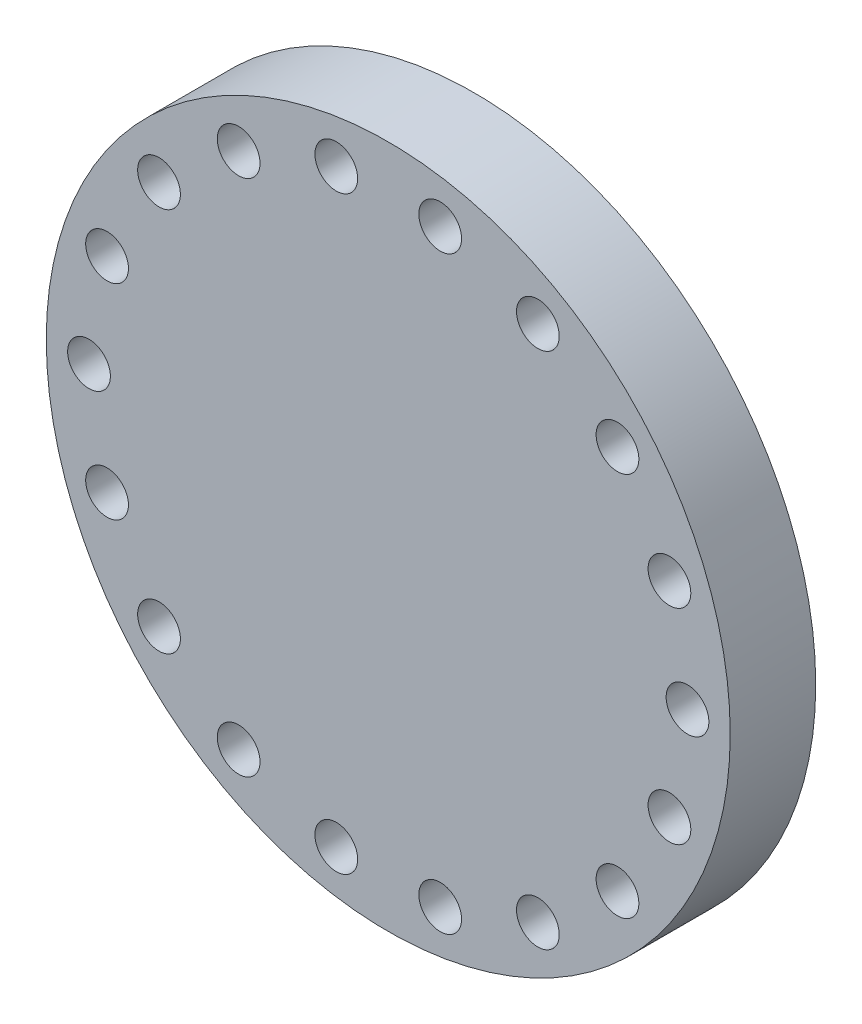
from build123d import *

# Parameters (mm, degrees)
SKETCH1_R           = 50.8
BOSS_EXTRUDE2_DEPTH = 12.7
SKETCH1_7_R         = 3.175
CUT_EXTRUDE1_DEPTH  = 12.7


with BuildPart() as part:
    # Sketch1 → Boss-Extrude2 (new body)
    with BuildSketch(Plane.XY):
        Circle(SKETCH1_R)
    extrude(amount=-BOSS_EXTRUDE2_DEPTH)

    # Sketch1<7> → Cut-Extrude1 (cut)
    with BuildSketch(Plane.XY):
        with Locations((-44.45, 0)):
            Circle(SKETCH1_7_R)
        with Locations((-41.769336994, 15.202795371)):
            Circle(SKETCH1_7_R)
        with Locations((-34.050675497, 28.571909251)):
            Circle(SKETCH1_7_R)
        with Locations((-22.225, 38.494829198)):
            Circle(SKETCH1_7_R)
        with Locations((-7.718661497, 43.774704621)):
            Circle(SKETCH1_7_R)
        with Locations((7.718661497, 43.774704621)):
            Circle(SKETCH1_7_R)
        with Locations((22.225, 38.494829198)):
            Circle(SKETCH1_7_R)
        with Locations((34.050675497, 28.571909251)):
            Circle(SKETCH1_7_R)
        with Locations((41.769336994, 15.202795371)):
            Circle(SKETCH1_7_R)
        with Locations((44.45, 0)):
            Circle(SKETCH1_7_R)
        with Locations((41.769336994, -15.202795371)):
            Circle(SKETCH1_7_R)
        with Locations((34.050675497, -28.571909251)):
            Circle(SKETCH1_7_R)
        with Locations((22.225, -38.494829198)):
            Circle(SKETCH1_7_R)
        with Locations((7.718661497, -43.774704621)):
            Circle(SKETCH1_7_R)
        with Locations((-7.718661497, -43.774704621)):
            Circle(SKETCH1_7_R)
        with Locations((-22.225, -38.494829198)):
            Circle(SKETCH1_7_R)
        with Locations((-34.050675497, -28.571909251)):
            Circle(SKETCH1_7_R)
        with Locations((-41.769336994, -15.202795371)):
            Circle(SKETCH1_7_R)
    extrude(amount=-CUT_EXTRUDE1_DEPTH, mode=Mode.SUBTRACT)


solid = part.part
